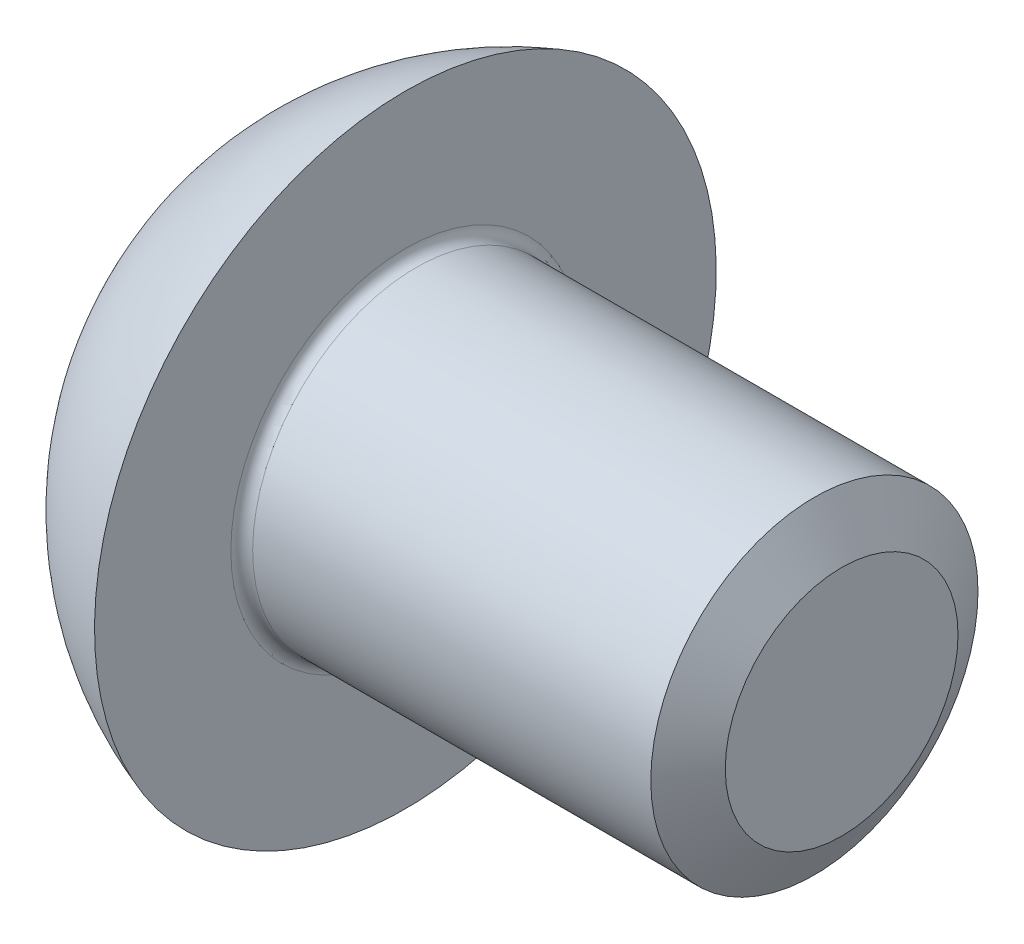
from build123d import *

# Parameters (mm, degrees)
CUT_EXTRUDE_1_DEPTH = 1.65


with BuildPart() as part:
    # 草图1 → 旋转1 (revolve)
    with BuildSketch(Plane.XY):
        with BuildLine():
            Line((0, 1.5), (-3.9, 1.5))
            ThreePointArc((-3.9, 1.5), (-3.970710678, 1.529289322), (-4, 1.6))
            Line((-4, 1.6), (-4, 2.85))
            ThreePointArc((-4, 2.85), (-4.948716751, 2.326209363), (-5.65, 1.5))
            Line((-5.65, 1.5), (-5.65, 0))
            Line((-5.65, 0), (0, 0))
            Line((0, 0), (0, 1.5))
        make_face()
    revolve(axis=Axis((-5.65, 0, 0), (1, 0, 0)))

    # 草图2 → 切除-拉伸1 (cut)
    with BuildSketch(Plane.ZY.offset(5.65)):
        Polygon((0, 1.154700538), (-1, 0.577350269), (-1, -0.577350269), (0, -1.154700538), (1, -0.577350269), (1, 0.577350269), align=None)
    extrude(amount=-CUT_EXTRUDE_1_DEPTH, mode=Mode.SUBTRACT)

    # 草图6 → 旋转2 (revolve)
    with BuildSketch(Plane.XY):
        Polygon((-4.61, 1.154700538), (-4, 0), (-3.7, 0), (-3.7, 1.154700538), align=None)
    revolve(axis=Axis((-5.65, 0, 0), (1, 0, 0)))

    # 草图7 → 切除-旋转5 (revolve, cut)
    with BuildSketch(Plane.XY):
        Polygon((-5.65, 1.154700538), (-5.35, 0), (-5.65, 0), align=None)
    revolve(axis=Axis((-5.65, 0, 0), (1, 0, 0)), mode=Mode.SUBTRACT)

    # 草图4 → 切除-旋转1 (revolve, cut)
    with BuildSketch(Plane.XY):
        Polygon((-0.25, 1.5), (0, 1.066987298), (0.25, 1.5), align=None)
    revolve(axis=Axis((-0.25, 0, 0), (1, 0, 0)), mode=Mode.SUBTRACT)


solid = part.part
